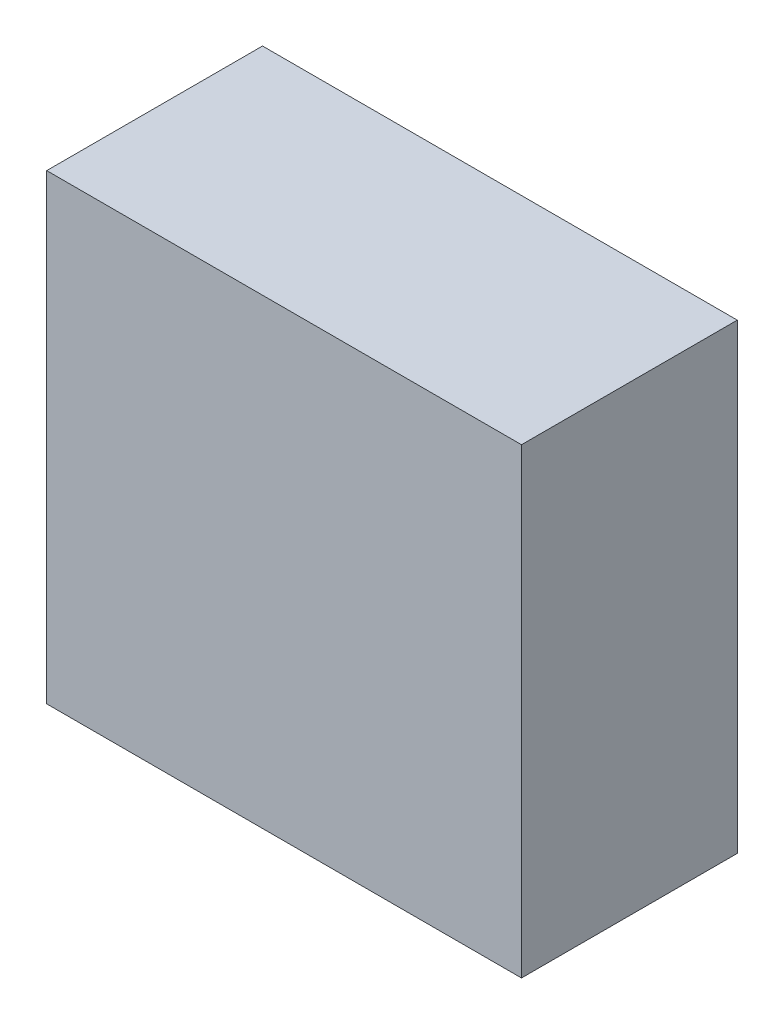
from build123d import *

# Parameters (mm, degrees)
SKETCH1_W           = 27.94
SKETCH1_H           = 12.7
BOSS_EXTRUDE1_DEPTH = 27.178


with BuildPart() as part:
    # Sketch1 → Boss-Extrude1 (new body)
    with BuildSketch(Plane(origin=(0, 0, 0), x_dir=(1, 0, 0), z_dir=(0, 1, 0))):
        with Locations((13.97, 6.35)):
            Rectangle(SKETCH1_W, SKETCH1_H)
    extrude(amount=BOSS_EXTRUDE1_DEPTH)


solid = part.part
